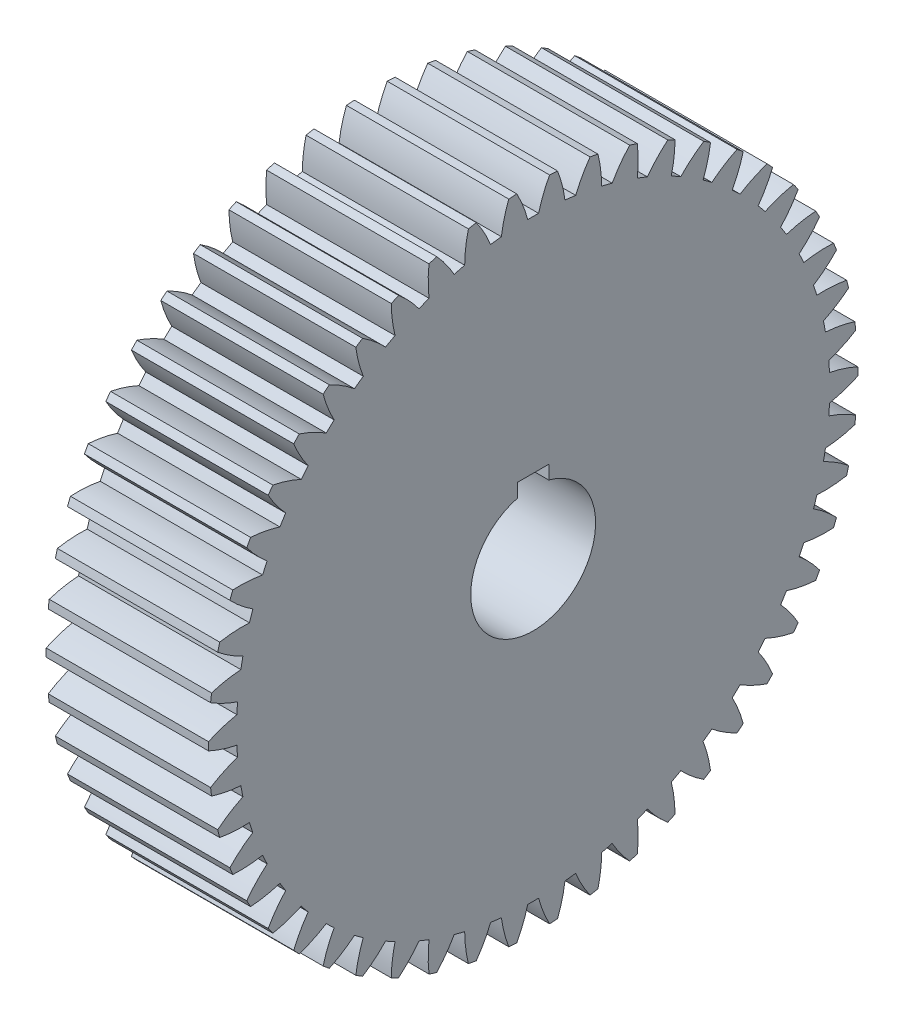
from build123d import *

# Parameters (mm, degrees)
BASPROSKE_W     = 41.275
BASPROSKE_H     = 82.55
TOOTHCUT_DEPTH  = 124.825
TEETHCUTS_COUNT = 50
TEETHCUTS_ANGLE = 352.8
BORSKE_R        = 15.875
BORE_DEPTH      = 50.8000508
KEYSKE_W        = 7.9248
KEYSKE_H        = 18.8468
KEYWAY_DEPTH    = 50.8000508


with BuildPart() as part:
    # BasProSke → Base-Revolve (revolve)
    with BuildSketch(Plane(origin=(0, 0, 0), x_dir=(1, 0, 0), z_dir=(0, 1, 0)), mode=Mode.PRIVATE) as base_revolve_sk:
        with Locations((20.6375, 41.275)):
            Rectangle(BASPROSKE_W, BASPROSKE_H)
    revolve(base_revolve_sk.sketch.rotate(Axis((-10, 0, 0), (1, 0, 0)), 180), axis=Axis((-10, 0, 0), (1, 0, 0)))

    # TooCutSke → ToothCut (cut, through all)
    with BuildSketch(Plane(origin=(0, 0, 0), x_dir=(0, 0, -1), z_dir=(1, 0, 0))):
        with BuildLine():
            ThreePointArc((1.379519889, 75.392359916), (0, 75.40498), (-1.379519889, 75.392359916))
            ThreePointArc((-1.379519889, 75.392359916), (-2.566989406, 79.015168837), (-4.180130785, 82.469528868))
            ThreePointArc((-4.180130785, 82.469528868), (0, 82.5754), (4.180130785, 82.469528868))
            ThreePointArc((4.180130785, 82.469528868), (2.566989406, 79.015168837), (1.379519889, 75.392359916))
        make_face()
    toothcut = extrude(amount=TOOTHCUT_DEPTH, mode=Mode.SUBTRACT)

    # TeethCuts: ToothCut ×50 about axis
    teethcuts_axis = Axis((-10, 0, 0), (1, 0, 0))
    for i in range(1, TEETHCUTS_COUNT):
        add(toothcut.rotate(teethcuts_axis, i * TEETHCUTS_ANGLE / (TEETHCUTS_COUNT - 1)), mode=Mode.SUBTRACT)

    # BorSke → Bore (cut, symmetric)
    with BuildSketch(Plane(origin=(0, 0, 0), x_dir=(0, 0, -1), z_dir=(1, 0, 0))):
        with Locations(Location((0, 0, 0), (0, 0, 180))):
            Circle(BORSKE_R)
    extrude(amount=BORE_DEPTH, both=True, mode=Mode.SUBTRACT)

    # KeySke → Keyway (cut, symmetric)
    with BuildSketch(Plane(origin=(0, 0, 0), x_dir=(0, 0, -1), z_dir=(1, 0, 0))):
        with Locations((0, 9.4234)):
            Rectangle(KEYSKE_W, KEYSKE_H)
    extrude(amount=KEYWAY_DEPTH, both=True, mode=Mode.SUBTRACT)


solid = part.part
